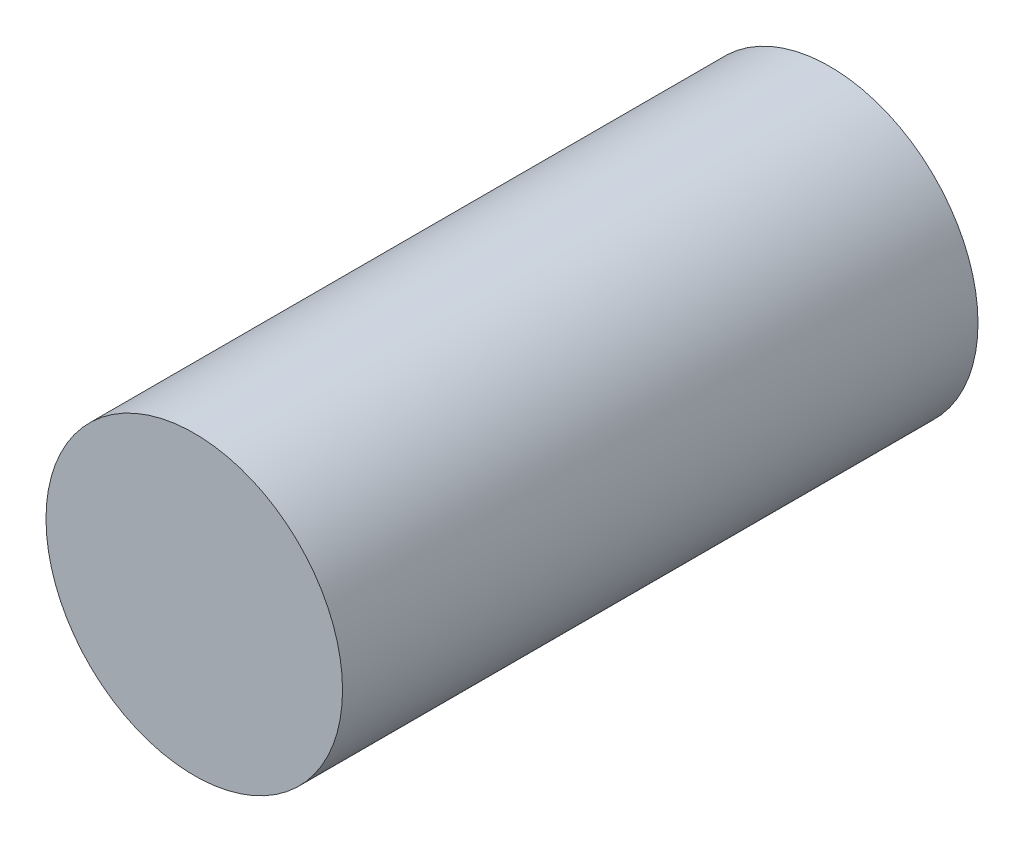
from build123d import *

# Parameters (mm, degrees)
SKETCH1_R                         = 7
MOTOR_ROTOR_OUTPUT_ENVELOPE_DEPTH = 30


with BuildPart() as part:
    # Sketch1 → Motor_Rotor_Output_Envelope (new body)
    with BuildSketch(Plane.XY):
        Circle(SKETCH1_R)
    extrude(amount=MOTOR_ROTOR_OUTPUT_ENVELOPE_DEPTH)


solid = part.part
